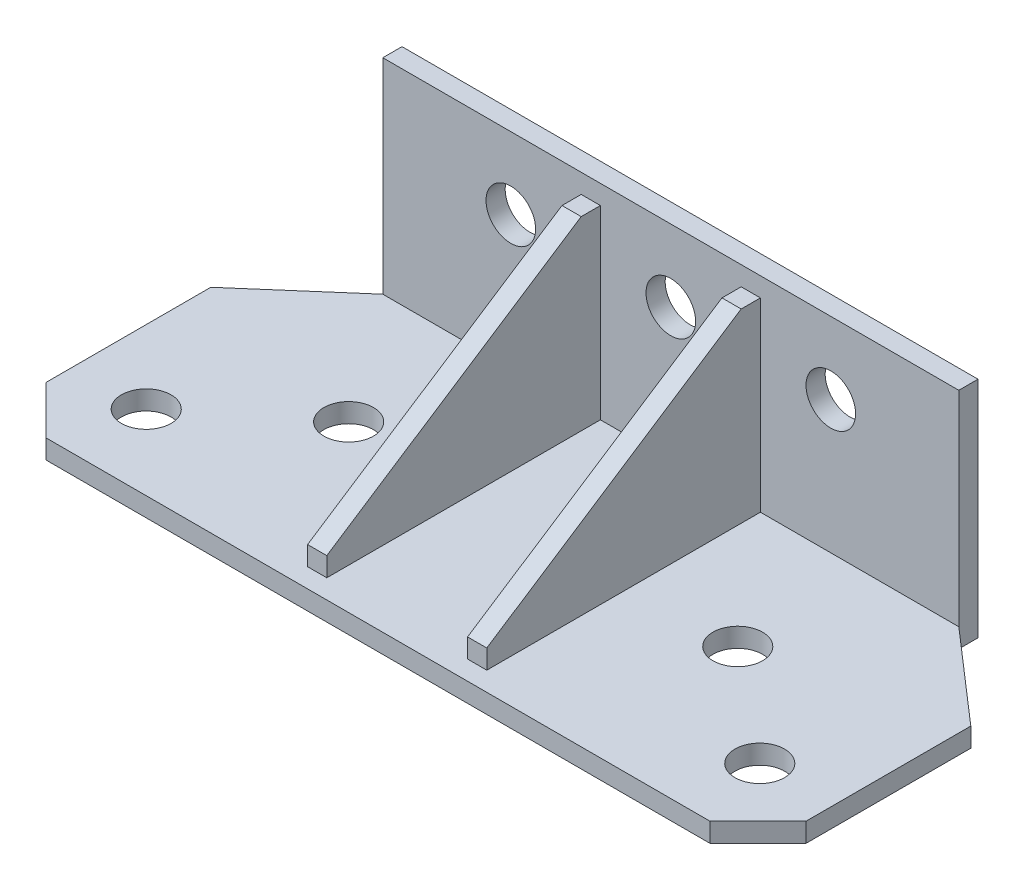
from build123d import *

# Parameters (mm, degrees)
SKETCH1_W      = 360
SKETCH1_H      = 140
SKETCH1_R      = 15.5
EXTRUDE1_DEPTH = 12
SKETCH2_W      = 475
SKETCH2_H      = 12
EXTRUDE2_DEPTH = 183
SKETCH3_R      = 15.5
EXTRUDE3_DEPTH = 183
SKETCH4_W      = 12
SKETCH4_H      = 116
EXTRUDE4_DEPTH = 171
EXTRUDE5_DEPTH = 183


with BuildPart() as part:
    # Sketch1 → Extrude1 (new body)
    with BuildSketch(Plane.XY):
        with Locations((180, 70)):
            Rectangle(SKETCH1_W, SKETCH1_H)
        with Locations((80, 95)):
            Circle(SKETCH1_R, mode=Mode.SUBTRACT)
        with Locations((180, 95)):
            Circle(SKETCH1_R, mode=Mode.SUBTRACT)
        with Locations((280, 95)):
            Circle(SKETCH1_R, mode=Mode.SUBTRACT)
    extrude(amount=EXTRUDE1_DEPTH)

    # Sketch2 → Extrude2 (add)
    with BuildSketch(Plane.XY.offset(12)):
        with Locations((180, 6)):
            Rectangle(SKETCH2_W, SKETCH2_H)
    extrude(amount=EXTRUDE2_DEPTH)

    # Sketch3 → Extrude3 (cut)
    with BuildSketch(Plane(origin=(0, 12, 0), x_dir=(1, 0, 0), z_dir=(0, 1, 0))):
        Polygon((360, -12), (417.5, -62), (417.5, -12), align=None)
        Polygon((417.5, -165), (387.5, -195), (417.5, -195), align=None)
        Polygon((-57.5, -165), (-57.5, -195), (-27.5, -195), align=None)
        Polygon((-57.5, -12), (-57.5, -62), (0, -12), align=None)
        with Locations(Location((58.413652083, -91.738221798, 0), (0, 0, 270))):
            Circle(SKETCH3_R)
        with Locations(Location((-11.732317869, -148.125657451, 0), (0, 0, 270))):
            Circle(SKETCH3_R)
        with Locations(Location((301.586347917, -91.738221798, 0), (0, 0, 270))):
            Circle(SKETCH3_R)
        with Locations(Location((371.732317869, -148.125657451, 0), (0, 0, 270))):
            Circle(SKETCH3_R)
    extrude(amount=-EXTRUDE3_DEPTH, mode=Mode.SUBTRACT)

    # Sketch4 → Extrude4 (add)
    with BuildSketch(Plane.XY.offset(12)):
        with Locations((130, 70)):
            Rectangle(SKETCH4_W, SKETCH4_H)
        with Locations((230, 70)):
            Rectangle(SKETCH4_W, SKETCH4_H)
    extrude(amount=EXTRUDE4_DEPTH)

    # Sketch5 → Extrude5 (cut)
    with BuildSketch(Plane.ZY.offset(-124)):
        Polygon((183, 128), (183, 24), (24, 128), align=None)
    extrude(amount=-EXTRUDE5_DEPTH, mode=Mode.SUBTRACT)


solid = part.part
